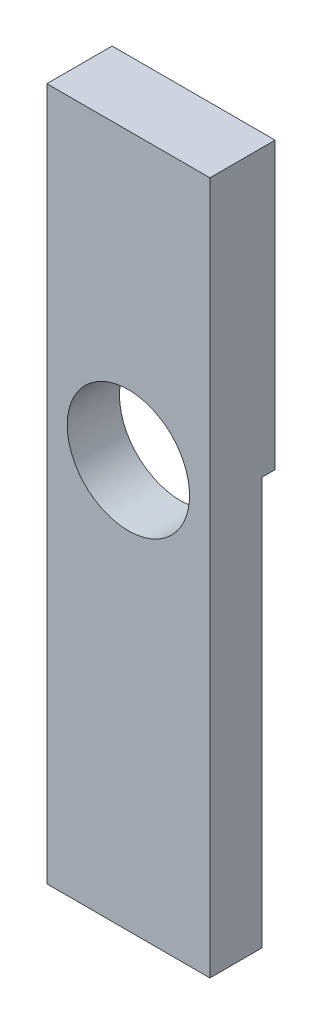
from build123d import *

# Parameters (mm, degrees)
SKETCH1_W           = 12.7
SKETCH1_H           = 53.975
BOSS_EXTRUDE1_DEPTH = 5.08
CUT_EXTRUDE1_DEPTH  = 1.016
SKETCH3_R           = 4.7625
CUT_EXTRUDE2_DEPTH  = 55.498983669


with BuildPart() as part:
    # Sketch1 → Boss-Extrude1 (new body)
    with BuildSketch(Plane.XY):
        with Locations((0, 26.9875)):
            Rectangle(SKETCH1_W, SKETCH1_H)
    extrude(amount=BOSS_EXTRUDE1_DEPTH)

    # Sketch2 → Cut-Extrude1 (cut)
    with BuildSketch(Plane.XY):
        with BuildLine():
            Line((-6.35, -31.75), (-6.35, 31.75))
            ThreePointArc((-6.35, 31.75), (0, 38.1), (6.35, 31.75))
            Line((6.35, 31.75), (6.35, -31.75))
            ThreePointArc((6.35, -31.75), (0, -38.1), (-6.35, -31.75))
        make_face()
    extrude(amount=CUT_EXTRUDE1_DEPTH, mode=Mode.SUBTRACT)

    # Sketch3 → Cut-Extrude2 (cut, through all)
    with BuildSketch(Plane(origin=(0, 0, 1.016), x_dir=(-1, 0, 0), z_dir=(0, 0, -1))):
        with Locations((0, 31.75)):
            Circle(SKETCH3_R)
    extrude(amount=-CUT_EXTRUDE2_DEPTH, mode=Mode.SUBTRACT)


solid = part.part
